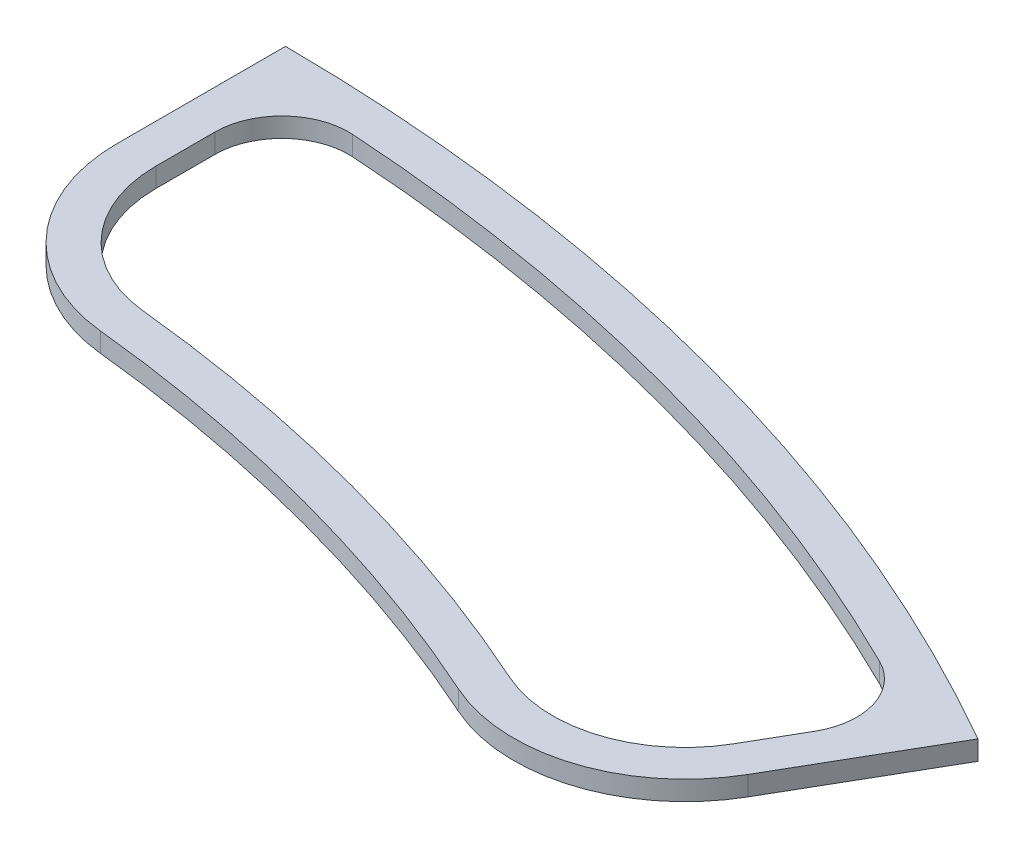
from build123d import *

# Parameters (mm, degrees)
BOSS_EXTRUDE1_DEPTH = 3
CUT_EXTRUDE1_DEPTH  = 3
FILLET1_R           = 10
FILLET2_R           = 3
BOSS_EXTRUDE2_DEPTH = 3
CUT_EXTRUDE2_DEPTH  = 3


with BuildPart() as part:
    # Sketch1 → Boss-Extrude1 (new body)
    with BuildSketch(Plane(origin=(0, 0, 0), x_dir=(1, 0, 0), z_dir=(0, 1, 0))):
        with BuildLine():
            Line((1.5, 297.496218463), (1.5, 271.496218463))
            ThreePointArc((1.5, 271.496218463), (70.269464473, 262.249211634), (134.449071126, 235.872622221))
            Line((134.449071126, 235.872622221), (147.449071126, 258.389282719))
            ThreePointArc((147.449071126, 258.389282719), (76.998665918, 287.362933321), (1.5, 297.496218463))
        make_face()
    extrude(amount=BOSS_EXTRUDE1_DEPTH)

    # Sketch3 → Cut-Extrude1 (cut)
    with BuildSketch(Plane(origin=(0, 3, 0), x_dir=(1, 0, 0), z_dir=(0, 1, 0))):
        with BuildLine():
            Line((7.5, 271.396751344), (129.203185143, 238.786481168))
            Line((129.203185143, 238.786481168), (136.70589842, 251.781561758))
            ThreePointArc((136.70589842, 251.781561758), (74.15175015, 276.738099028), (7.5, 286.402177897))
            Line((7.5, 286.402177897), (7.5, 271.396751344))
        make_face()
    extrude(amount=-CUT_EXTRUDE1_DEPTH, mode=Mode.SUBTRACT)

    # Fillet1
    fillet1_edges = [part.edges().sort_by_distance(p)[0] for p in [
        (7.5, 1.5, -286.402177897),
        (136.70589842, 1.5, -251.781561758),
    ]]
    fillet(fillet1_edges, radius=FILLET1_R)

    # Fillet2
    fillet2_edges = [part.edges().sort_by_distance(p)[0] for p in [
        (7.5, 1.5, -271.396751344),
        (129.203185143, 1.5, -238.786481168),
    ]]
    fillet(fillet2_edges, radius=FILLET2_R)

    # Sketch4 → Boss-Extrude2 (add)
    with BuildSketch(Plane(origin=(0, 3, 0), x_dir=(1, 0, 0), z_dir=(0, 1, 0))):
        with BuildLine():
            Line((129.252918703, 238.872622221), (130.736546702, 241.442341293))
            Line((130.736546702, 241.442341293), (134.449071126, 235.872622221))
            ThreePointArc((134.449071126, 235.872622221), (119.700341049, 223.942829747), (100.758430139, 224.967036005))
            ThreePointArc((100.758430139, 224.967036005), (63.798988345, 238.101065977), (25.224157857, 245.206383264))
            ThreePointArc((25.224157857, 245.206383264), (8.307878683, 253.79035008), (1.5, 271.496218463))
            Line((1.5, 271.496218463), (7.5, 274.46347446))
            Line((7.5, 274.46347446), (7.5, 271.496218463))
            ThreePointArc((7.5, 271.496218463), (12.762306102, 257.810061061), (25.838132399, 251.174886867))
            ThreePointArc((25.838132399, 251.174886867), (65.351902616, 243.896620934), (103.21096439, 230.44289902))
            ThreePointArc((103.21096439, 230.44289902), (117.852549236, 229.651215281), (129.252918703, 238.872622221))
        make_face()
    extrude(amount=-BOSS_EXTRUDE2_DEPTH)

    # Sketch5 → Cut-Extrude2 (cut)
    with BuildSketch(Plane(origin=(0, 3, 0), x_dir=(1, 0, 0), z_dir=(0, 1, 0))):
        with BuildLine():
            Line((131.477814314, 242.72625446), (133.824291098, 246.790471469))
            ThreePointArc((133.824291098, 246.790471469), (134.763656185, 254.918092038), (129.480348672, 261.165274172))
            ThreePointArc((129.480348672, 261.165274172), (75.445845375, 281.56772816), (18.449365845, 290.915936355))
            ThreePointArc((18.449365845, 290.915936355), (10.750296256, 288.147371682), (7.5, 280.638963253))
            Line((7.5, 280.638963253), (7.5, 275.946009685))
            Line((7.5, 275.946009685), (131.477814314, 242.72625446))
        make_face()
    extrude(amount=-CUT_EXTRUDE2_DEPTH, mode=Mode.SUBTRACT)


solid = part.part
